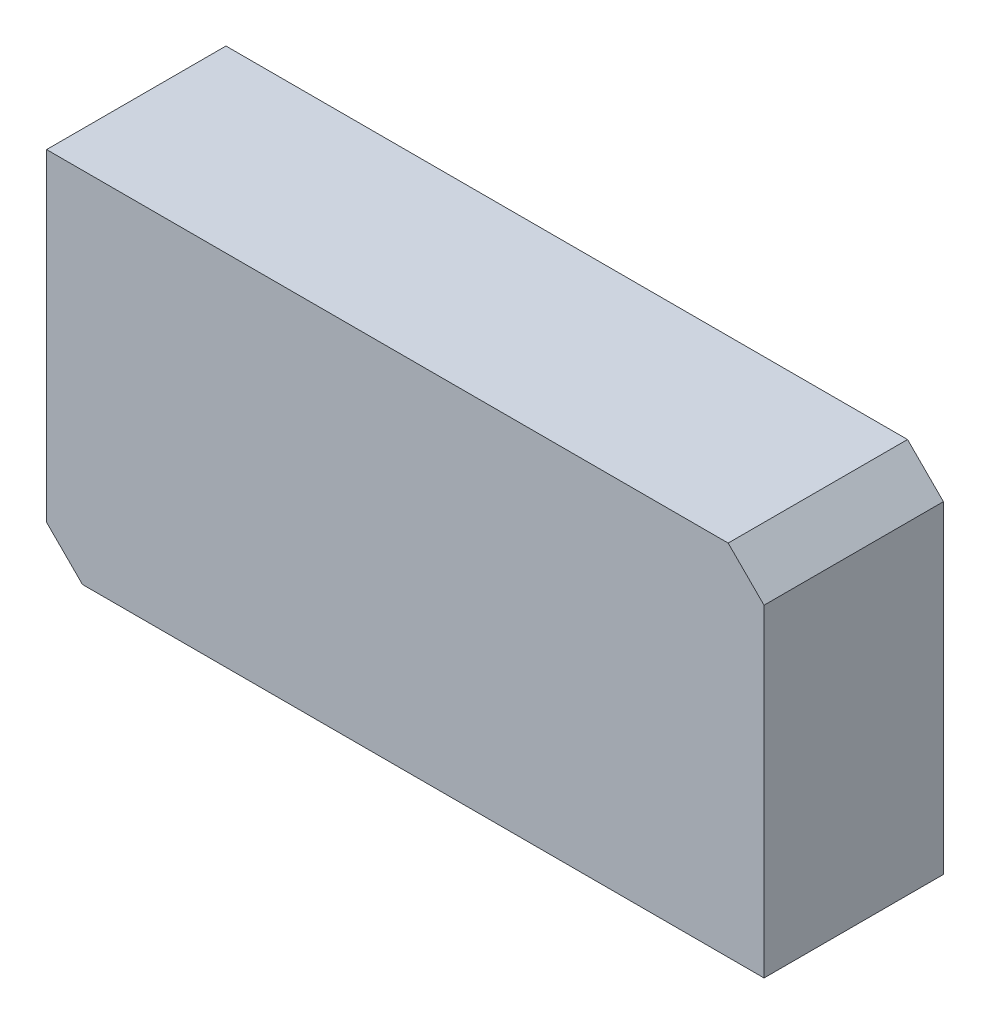
from build123d import *

# Parameters (mm, degrees)
SKETCH1_W           = 40
SKETCH1_H           = 20
BOSS_EXTRUDE1_DEPTH = 10
CHAMFER1_SIZE       = 2


with BuildPart() as part:
    # Sketch1 → Boss-Extrude1 (new body)
    with BuildSketch(Plane.XY):
        with Locations((20, 10)):
            Rectangle(SKETCH1_W, SKETCH1_H)
    extrude(amount=BOSS_EXTRUDE1_DEPTH)

    # Chamfer1
    chamfer1_edges = [part.edges().sort_by_distance(p)[0] for p in [
        (40, 20, 5),
        (0, 0, 5),
    ]]
    chamfer(chamfer1_edges, length=CHAMFER1_SIZE)


solid = part.part
